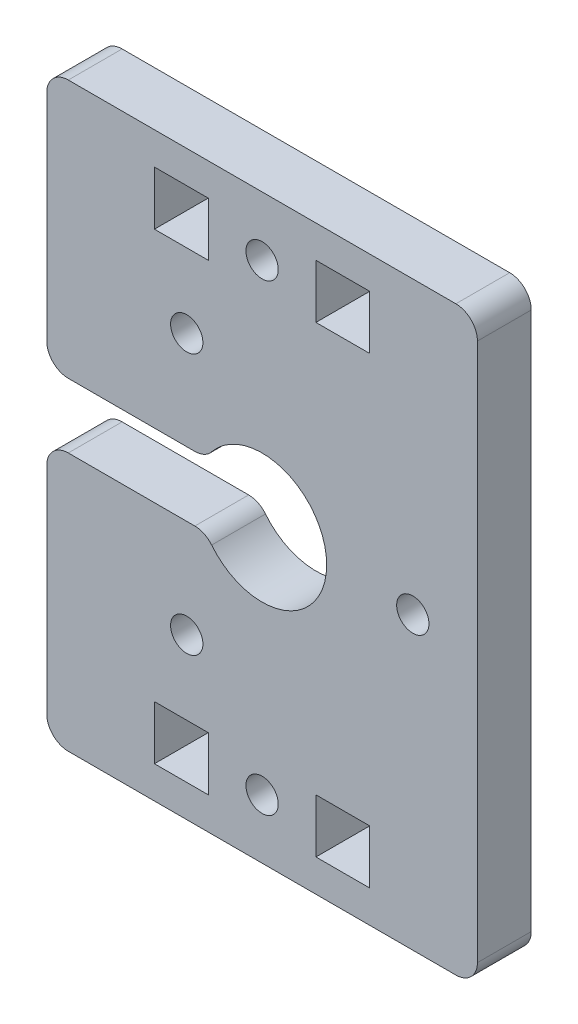
from build123d import *

# Parameters (mm, degrees)
ESQUISSE1_R        = 1.5
ESQUISSE1_W        = 5
ESQUISSE1_H        = 5
BOSS_EXTRU_1_DEPTH = 5
CONG_1_R           = 2


with BuildPart() as part:
    # Esquisse1 → Boss.-Extru.1 (new body)
    with BuildSketch(Plane.XY):
        with BuildLine():
            Line((-20, 27), (20, 27))
            Line((20, 27), (20, -27))
            Line((20, -27), (-20, -27))
            Line((-20, -27), (-20, -3))
            Line((-20, -3), (-5.196152423, -3))
            ThreePointArc((-5.196152423, -3), (6, 0), (-5.196152423, 3))
            Line((-5.196152423, 3), (-20, 3))
            Line((-20, 3), (-20, 27))
        make_face()
        with Locations((14, 0)):
            Circle(ESQUISSE1_R, mode=Mode.SUBTRACT)
        with Locations((-7, -12.124355653)):
            Circle(ESQUISSE1_R, mode=Mode.SUBTRACT)
        with Locations((-7, 12.124355653)):
            Circle(ESQUISSE1_R, mode=Mode.SUBTRACT)
        with Locations((0, 21.5)):
            Circle(ESQUISSE1_R, mode=Mode.SUBTRACT)
        with Locations(Location((0, -21.5, 0), (0, 0, 90))):
            Circle(ESQUISSE1_R, mode=Mode.SUBTRACT)
        with Locations((-7.5, 21.5)):
            Rectangle(ESQUISSE1_W, ESQUISSE1_H, mode=Mode.SUBTRACT)
        with Locations((7.5, 21.5)):
            Rectangle(ESQUISSE1_W, ESQUISSE1_H, mode=Mode.SUBTRACT)
        with Locations((-7.5, -21.5)):
            Rectangle(ESQUISSE1_W, ESQUISSE1_H, mode=Mode.SUBTRACT)
        with Locations((7.5, -21.5)):
            Rectangle(ESQUISSE1_W, ESQUISSE1_H, mode=Mode.SUBTRACT)
    extrude(amount=BOSS_EXTRU_1_DEPTH)

    # Congé1
    cong_1_edges = [part.edges().sort_by_distance(p)[0] for p in [
        (-20, -27, 2.5),
        (-20, -3, 2.5),
        (-5.196152423, -3, 2.5),
        (-5.196152423, 3, 2.5),
        (-20, 3, 2.5),
        (-20, 27, 2.5),
        (20, 27, 2.5),
        (20, -27, 2.5),
    ]]
    fillet(cong_1_edges, radius=CONG_1_R)


solid = part.part
